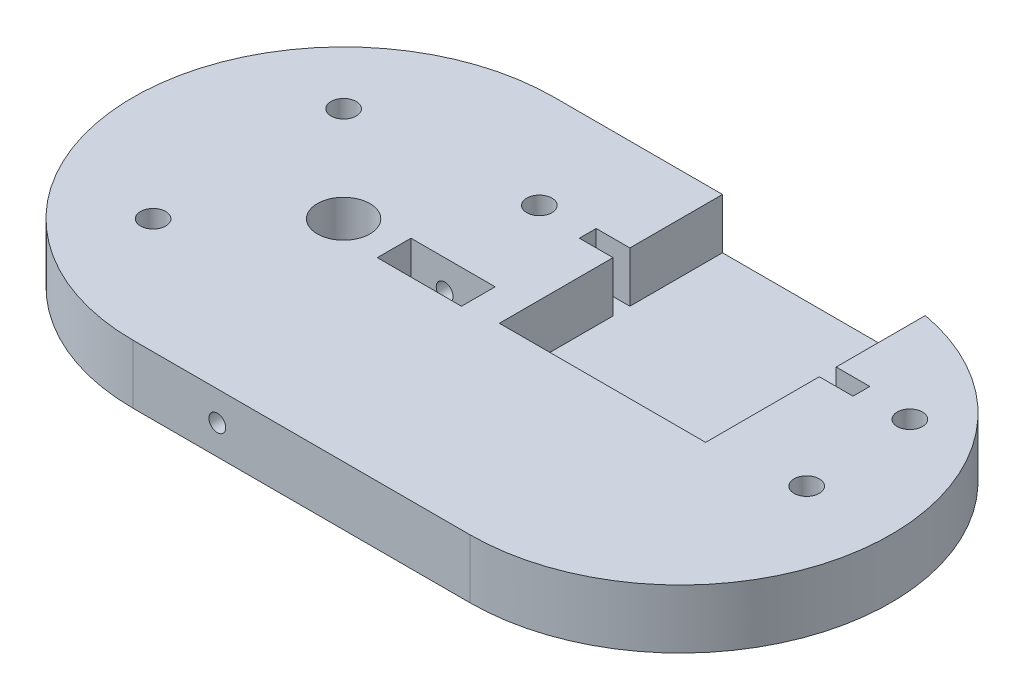
from build123d import *

# Parameters (mm, degrees)
BOSS_EXTRU_1_DEPTH      = 7
ESQUISSE2_R             = 3.125
ENL_V_MAT_EXTRU_1_DEPTH = 7
ENL_V_MAT_EXTRU_2_DEPTH = 6
ENL_V_MAT_EXTRU_3_REACH = 102.076
ESQUISSE4_W             = 8
ESQUISSE4_H             = 4
CHANFREIN1_SIZE         = 2
ESQUISSE5_R             = 1
ENL_V_MAT_EXTRU_4_DEPTH = 110.041839956
ESQUISSE7_R             = 1.5
ENL_V_MAT_EXTRU_6_DEPTH = 8


with BuildPart() as part:
    # Esquisse1 → Boss.-Extru.1 (new body)
    with BuildSketch(Plane(origin=(0, 0, 0), x_dir=(1, 0, 0), z_dir=(0, 1, 0))):
        with BuildLine():
            Line((-71.649484536, 25), (-31.649484536, 25))
            ThreePointArc((-31.649484536, 25), (-6.649484536, 0), (-31.649484536, -25))
            Line((-31.649484536, -25), (-71.649484536, -25))
            ThreePointArc((-71.649484536, -25), (-96.649484536, 0), (-71.649484536, 25))
        make_face()
    extrude(amount=BOSS_EXTRU_1_DEPTH)

    # Esquisse2 → Enlèv. mat.-Extru.1 (cut)
    with BuildSketch(Plane(origin=(0, 7, 0), x_dir=(1, 0, 0), z_dir=(0, 1, 0))):
        with Locations(Location((-71.649484536, 0, 0), (0, 0, 270))):
            Circle(ESQUISSE2_R)
    extrude(amount=-ENL_V_MAT_EXTRU_1_DEPTH, mode=Mode.SUBTRACT)

    # Esquisse3 → Enlèv. mat.-Extru.2 (cut)
    with BuildSketch(Plane(origin=(0, 7, 0), x_dir=(1, 0, 0), z_dir=(0, 1, 0))):
        Polygon((-51.649484536, 30.5), (-27.149484536, 30.5), (-27.149484536, 14), (-23.149484536, 14), (-23.149484536, 12), (-27.149484536, 12), (-27.149484536, -1.5), (-51.649484536, -1.5), (-51.649484536, 12), (-55.649484536, 12), (-55.649484536, 14), (-51.649484536, 14), align=None)
    extrude(amount=-ENL_V_MAT_EXTRU_2_DEPTH, mode=Mode.SUBTRACT)

    # Esquisse4 → Enlèv. mat.-Extru.3 (cut, up to next)
    with BuildSketch(Plane(origin=(0, 7, 0), x_dir=(1, 0, 0), z_dir=(0, 1, 0)), mode=Mode.PRIVATE) as enl_v_mat_extru_3_sk1:
        with Locations((-61.649484536, 0)):
            Rectangle(ESQUISSE4_W, ESQUISSE4_H)
    enl_v_mat_extru_3_tool1 = extrude(enl_v_mat_extru_3_sk1.sketch, amount=-ENL_V_MAT_EXTRU_3_REACH, mode=Mode.PRIVATE) & part.part
    add(enl_v_mat_extru_3_tool1.solids().sort_by_distance((-61.649485, 7, 0))[0], mode=Mode.SUBTRACT)

    # Chanfrein1
    chanfrein1_edges = [part.edges().sort_by_distance(p)[0] for p in [
        (-57.649484536, 7, 0),
    ]]
    chamfer(chanfrein1_edges, length=CHANFREIN1_SIZE)

    # Esquisse5 → Enlèv. mat.-Extru.4 (cut, through all)
    with BuildSketch(Plane.XY.offset(25)):
        with Locations((-61.649484536, 3.5)):
            Circle(ESQUISSE5_R)
    extrude(amount=-ENL_V_MAT_EXTRU_4_DEPTH, mode=Mode.SUBTRACT)

    # Esquisse7 → Enlèv. mat.-Extru.6 (cut)
    with BuildSketch(Plane(origin=(0, 7, 0), x_dir=(1, 0, 0), z_dir=(0, 1, 0))):
        with Locations(Location((-16.649484536, 0, 0), (0, 0, 270))):
            Circle(ESQUISSE7_R)
        with Locations(Location((-82.963193035, 11.313708499, 0), (0, 0, 270))):
            Circle(ESQUISSE7_R)
        with Locations(Location((-82.963193035, -11.313708499, 0), (0, 0, 270))):
            Circle(ESQUISSE7_R)
        with Locations(Location((-61.399484536, 13, 0), (0, 0, 270))):
            Circle(ESQUISSE7_R)
        with Locations(Location((-17.399484536, 13, 0), (0, 0, 270))):
            Circle(ESQUISSE7_R)
    extrude(amount=-ENL_V_MAT_EXTRU_6_DEPTH, mode=Mode.SUBTRACT)


solid = part.part
